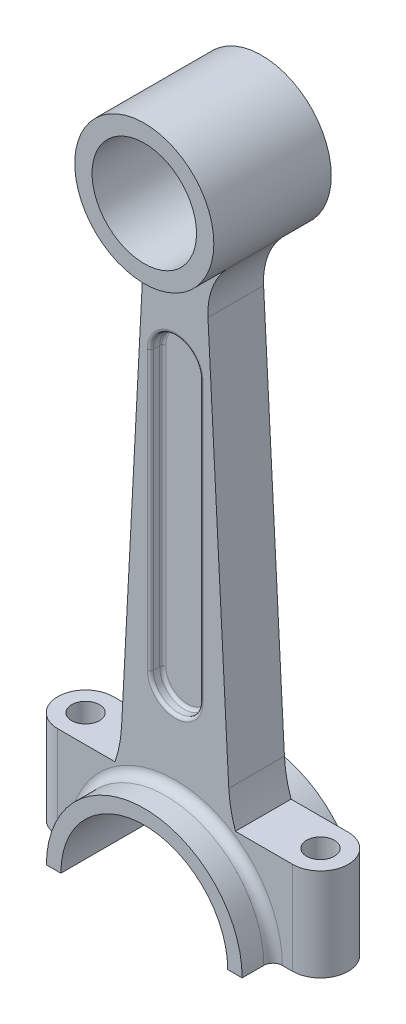
from build123d import *

# Parameters (mm, degrees)
SKETCH1_R             = 22.5
SKETCH1_R_2           = 16.9
BOSS_EXTRUDE1_DEPTH   = 19
BOSS_EXTRUDE1_2_DEPTH = 19
BOSS_EXTRUDE2_DEPTH   = 9
CUT_EXTRUDE1_DEPTH    = 4
FILLET1_R             = 1
FILLET2_R             = 1
FILLET3_R             = 40
FILLET5_R             = 22.5
BOSS_EXTRUDE3_DEPTH   = 30
CUT_EXTRUDE2_DEPTH    = 209.505251732
SKETCH5_R             = 4.5
CUT_EXTRUDE3_DEPTH    = 201.224099449
FILLET6_R             = 3


with BuildPart() as part:
    # Sketch1 → Boss-Extrude1 (new, symmetric)
    with BuildSketch(Plane.XY):
        Circle(SKETCH1_R)
        Circle(SKETCH1_R_2, mode=Mode.SUBTRACT)
    extrude(amount=BOSS_EXTRUDE1_DEPTH, both=True)



with BuildPart() as body_2:
    # Sketch1 → Boss-Extrude1 2 (new, symmetric)
    with BuildSketch(Plane.XY):
        with BuildLine():
            Line((-31.672210335, -201.2), (-27, -201.2))
            ThreePointArc((-27, -201.2), (0, -174.2), (27, -201.2))
            Line((27, -201.2), (31.672210335, -201.2))
            ThreePointArc((31.672210335, -201.2), (0, -169.527789665), (-31.672210335, -201.2))
        make_face()
    extrude(amount=BOSS_EXTRUDE1_2_DEPTH, both=True)


with BuildPart() as part_1:
    add(part.part)

    add(body_2.part)  # Boss-Extrude2 merges body 2
    # Sketch1<3> → Boss-Extrude2 (add, symmetric)
    with BuildSketch(Plane.XY):
        with BuildLine():
            ThreePointArc((10, -20.155644371), (5.135562367, -21.906072199), (0, -22.5))
            Line((0, -22.5), (0, -169.527789665))
            ThreePointArc((0, -169.527789665), (9.501072175, -170.986451134), (18.127001897, -175.228078436))
            Line((18.127001897, -175.228078436), (10, -20.155644371))
        make_face()
        with BuildLine():
            Line((0, -169.527789665), (0, -22.5))
            ThreePointArc((0, -22.5), (-5.135562367, -21.906072199), (-10, -20.155644371))
            Line((-10, -20.155644371), (-18.127001897, -175.228078436))
            ThreePointArc((-18.127001897, -175.228078436), (-9.501072175, -170.986451134), (0, -169.527789665))
        make_face()
    extrude(amount=BOSS_EXTRUDE2_DEPTH, both=True)

    # Sketch2 → Cut-Extrude1 (cut)
    with BuildSketch(Plane.XY.offset(9)):
        with BuildLine():
            Line((8, -50.284483382), (8, -140.284483382))
            ThreePointArc((8, -140.284483382), (0, -148.284483382), (-8, -140.284483382))
            Line((-8, -140.284483382), (-8, -50.284483382))
            ThreePointArc((-8, -50.284483382), (0, -42.284483382), (8, -50.284483382))
        make_face()
    cut_extrude1 = extrude(amount=-CUT_EXTRUDE1_DEPTH, mode=Mode.SUBTRACT)

    # Mirror1: Cut-Extrude1 across plane
    add(cut_extrude1.mirror(Plane.XY), mode=Mode.SUBTRACT)

    # Fillet1
    fillet1_edges = [part_1.edges().sort_by_distance(p)[0] for p in [
        (0, -42.284483382, 5),
        (8, -95.284483382, 5),
        (0, -148.284483382, 5),
        (-8, -95.284483382, 5),
        (0, -42.284483382, 9),
        (-8, -95.284483382, 9),
        (0, -148.284483382, 9),
        (8, -95.284483382, 9),
    ]]
    fillet(fillet1_edges, radius=FILLET1_R)

    # Fillet2
    fillet2_edges = [part_1.edges().sort_by_distance(p)[0] for p in [
        (0, -42.284483382, -9),
        (-8, -95.284483382, -9),
        (0, -148.284483382, -9),
        (8, -95.284483382, -9),
        (0, -42.284483382, -5),
        (-8, -95.284483382, -5),
        (0, -148.284483382, -5),
        (8, -95.284483382, -5),
    ]]
    fillet(fillet2_edges, radius=FILLET2_R)

    # Fillet3
    fillet3_edges = [part_1.edges().sort_by_distance(p)[0] for p in [
        (-18.127001897, -175.228078436, 0),
        (18.127001897, -175.228078436, 0),
    ]]
    fillet(fillet3_edges, radius=FILLET3_R)

    # Fillet5
    fillet5_edges = [part_1.edges().sort_by_distance(p)[0] for p in [
        (10, -20.155644371, 0),
        (-10, -20.155644371, 0),
    ]]
    fillet(fillet5_edges, radius=FILLET5_R)

    # Sketch3 → Boss-Extrude3 (add)
    with BuildSketch(Plane(origin=(0, -171.2, 0), x_dir=(-1, 0, 0), z_dir=(0, -1, 0))):
        with BuildLine():
            Line((38, -9), (-38, -9))
            ThreePointArc((-38, -9), (-47, 0), (-38, 9))
            Line((-38, 9), (38, 9))
            ThreePointArc((38, 9), (47, 0), (38, -9))
        make_face()
    extrude(amount=BOSS_EXTRUDE3_DEPTH)

    # Sketch4 → Cut-Extrude2 (cut, through all)
    with BuildSketch(Plane.XY.offset(9)):
        with BuildLine():
            Line((-27, -201.2), (27, -201.2))
            ThreePointArc((27, -201.2), (0, -174.2), (-27, -201.2))
        make_face()
    extrude(amount=-CUT_EXTRUDE2_DEPTH, mode=Mode.SUBTRACT)

    # Sketch5 → Cut-Extrude3 (cut, through all)
    with BuildSketch(Plane(origin=(0, -171.2, 0), x_dir=(1, 0, 0), z_dir=(0, 1, 0))):
        with Locations(Location((-38, 0, 0), (0, 0, 270))):
            Circle(SKETCH5_R)
        with Locations(Location((38, 0, 0), (0, 0, 270))):
            Circle(SKETCH5_R)
    extrude(amount=-CUT_EXTRUDE3_DEPTH, mode=Mode.SUBTRACT)

    # Fillet6
    fillet6_edges = [part_1.edges().sort_by_distance(p)[0] for p in [
        (0, -169.527789665, 9),
        (0, -169.527789665, -9),
    ]]
    fillet(fillet6_edges, radius=FILLET6_R)


solid = part_1.part
